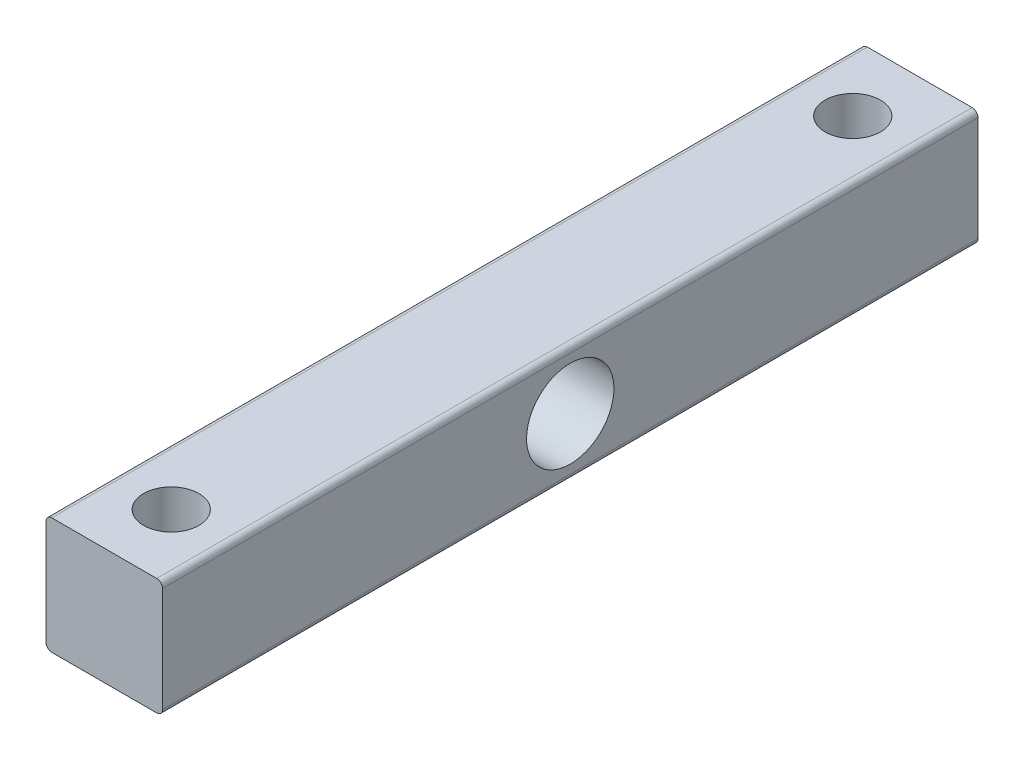
from build123d import *

# Parameters (mm, degrees)
SKETCH7_W           = 5.08
SKETCH7_H           = 5.08
BOSS_EXTRUDE3_DEPTH = 17.78
SKETCH8_R           = 1.2065
CUT_EXTRUDE1_DEPTH  = 5.08
FILLET1_R           = 0.254
SKETCH11_R          = 1.905
CUT_EXTRUDE2_DEPTH  = 5.08


with BuildPart() as part:
    # Sketch7 → Boss-Extrude3 (new body)
    with BuildSketch(Plane.XY):
        with Locations((2.448966181, 0.143745058)):
            Rectangle(SKETCH7_W, SKETCH7_H)
    boss_extrude3 = extrude(amount=BOSS_EXTRUDE3_DEPTH)

    # Sketch8 → Cut-Extrude1 (cut)
    with BuildSketch(Plane(origin=(0, 2.683745058, 0), x_dir=(1, 0, 0), z_dir=(0, 1, 0))):
        with Locations(Location((2.448966181, -14.859, 0), (0, 0, 270))):
            Circle(SKETCH8_R)
    cut_extrude1 = extrude(amount=-CUT_EXTRUDE1_DEPTH, mode=Mode.SUBTRACT)

    # Mirror2: Boss-Extrude3, Cut-Extrude1 across plane
    add(boss_extrude3.mirror(Plane.XY))
    add(cut_extrude1.mirror(Plane.XY), mode=Mode.SUBTRACT)

    # Fillet1
    fillet1_edges = [part.edges().sort_by_distance(p)[0] for p in [
        (-0.091033819, 2.683745058, 0),
        (4.988966181, 2.683745058, 0),
        (4.988966181, -2.396254942, 0),
        (-0.091033819, -2.396254942, 0),
    ]]
    fillet(fillet1_edges, radius=FILLET1_R)

    # Sketch11 → Cut-Extrude2 (cut)
    with BuildSketch(Plane.ZY.offset(0.091033819)):
        with Locations(Location((0, 0.143745058, 0), (0, 0, 270))):
            Circle(SKETCH11_R)
    extrude(amount=-CUT_EXTRUDE2_DEPTH, mode=Mode.SUBTRACT)


solid = part.part
